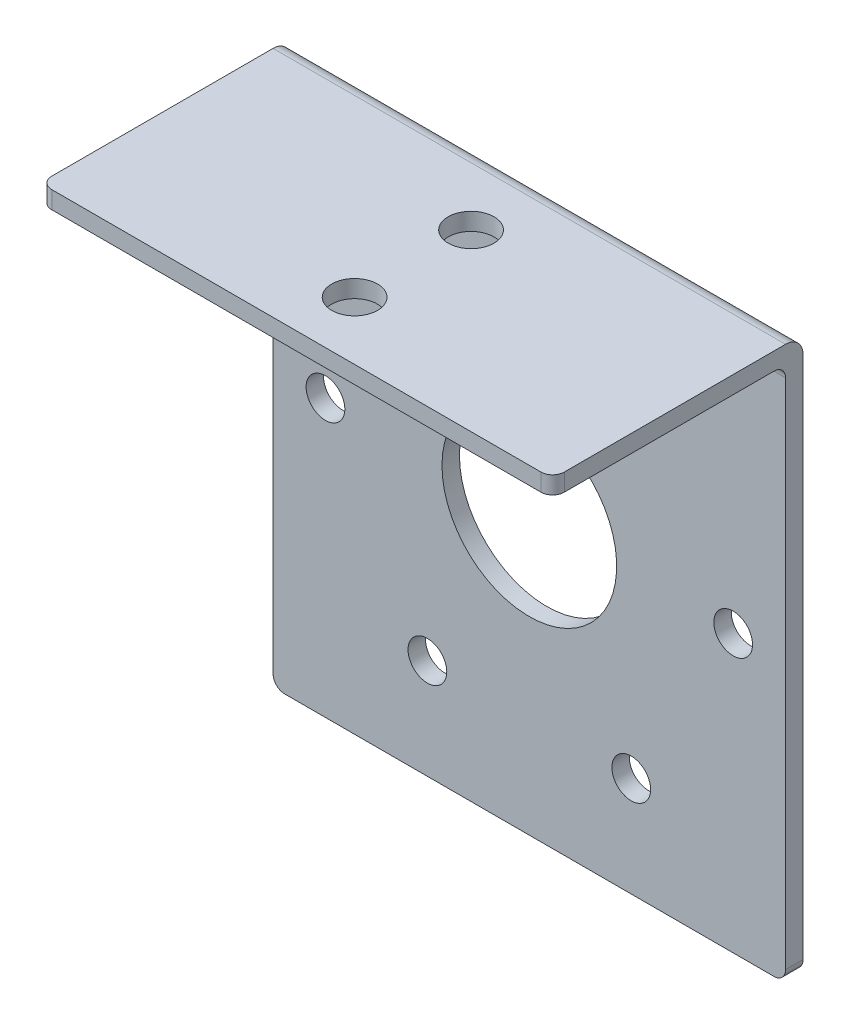
from build123d import *

# Parameters (mm, degrees)
SKETCH1_W                = 88
SKETCH1_H                = 95
BOSS_EXTRUDE1_DEPTH      = 3
BOSS_EXTRUDE2_DEPTH      = 40
BOSS_EXTRUDE2_DEPTH_BACK = 1
SKETCH2_W                = 88
SKETCH2_H                = 3
SKETCH3_R                = 15
CUT_EXTRUDE1_DEPTH       = 10
FILLET1_R                = 3
FILLET2_R                = 2
SKETCH5_R                = 3.935
CUT_EXTRUDE3_DEPTH       = 10
LPATTERN1_COUNT          = 2
LPATTERN1_PITCH          = 20
FILLET3_R                = 2
SKETCH6_R                = 3.325
CUT_EXTRUDE4_DEPTH       = 10
CIRPATTERN1_COUNT        = 6


with BuildPart() as part:
    # Sketch1 → Boss-Extrude1 (new body)
    with BuildSketch(Plane.XY):
        Rectangle(SKETCH1_W, SKETCH1_H)
    extrude(amount=BOSS_EXTRUDE1_DEPTH)

    # Sketch2 → Boss-Extrude2 (add, two sides: drawn at the far end of the back side and taken through both)
    with BuildSketch(Plane.XY.offset(3).offset(-BOSS_EXTRUDE2_DEPTH_BACK)):
        with Locations((0, 46)):
            Rectangle(SKETCH2_W, SKETCH2_H)
    extrude(amount=BOSS_EXTRUDE2_DEPTH + BOSS_EXTRUDE2_DEPTH_BACK)

    # Sketch3 → Cut-Extrude1 (cut)
    with BuildSketch(Plane(origin=(0, 0, 0), x_dir=(-1, 0, 0), z_dir=(0, 0, -1))):
        Circle(SKETCH3_R)
    extrude(amount=-CUT_EXTRUDE1_DEPTH, mode=Mode.SUBTRACT)

    # Fillet1
    fillet1_edges = [part.edges().sort_by_distance(p)[0] for p in [
        (0, 47.5, 0),
    ]]
    fillet(fillet1_edges, radius=FILLET1_R)

    # Fillet2
    fillet2_edges = [part.edges().sort_by_distance(p)[0] for p in [
        (0, 44.5, 3),
    ]]
    fillet(fillet2_edges, radius=FILLET2_R)

    # Sketch5 → Cut-Extrude3 (cut)
    with BuildSketch(Plane(origin=(0, 47.5, 0), x_dir=(1, 0, 0), z_dir=(0, 1, 0))):
        with Locations(Location((0, -13, 0), (0, 0, 270))):
            Circle(SKETCH5_R)
    cut_extrude3 = extrude(amount=-CUT_EXTRUDE3_DEPTH, mode=Mode.SUBTRACT)

    # LPattern1: Cut-Extrude3 ×2
    with Locations(*[(0, 0, i * LPATTERN1_PITCH) for i in range(1, LPATTERN1_COUNT)]):
        add(cut_extrude3, mode=Mode.SUBTRACT)

    # Fillet3
    fillet3_edges = [part.edges().sort_by_distance(p)[0] for p in [
        (-44, 46, 43),
        (44, 46, 43),
        (44, -47.5, 1.5),
        (-44, -47.5, 1.5),
    ]]
    fillet(fillet3_edges, radius=FILLET3_R)

    # Sketch6 → Cut-Extrude4 (cut)
    with BuildSketch(Plane.XY.offset(3)):
        with Locations((35, 0)):
            Circle(SKETCH6_R)
    cut_extrude4 = extrude(amount=-CUT_EXTRUDE4_DEPTH, mode=Mode.SUBTRACT)

    # CirPattern1: Cut-Extrude4 ×6 about axis
    cirpattern1_axis = Axis((0, 0, 0), (0, 0, 1))
    for i in range(1, CIRPATTERN1_COUNT):
        add(cut_extrude4.rotate(cirpattern1_axis, i * 360 / CIRPATTERN1_COUNT), mode=Mode.SUBTRACT)


solid = part.part
